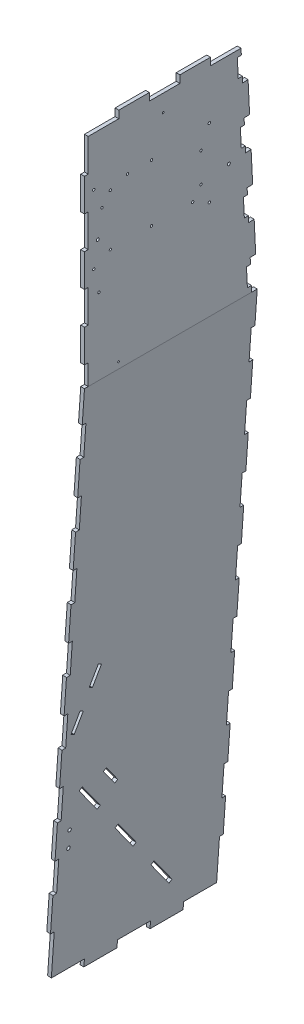
from build123d import *

# Parameters (mm, degrees)
BOSS_EXTRUDE1_DEPTH      = 469.9
SKETCH2_W                = 10.16
SKETCH2_H                = 83.651125112
SKETCH2_H_2              = 83.677721465
SKETCH2_H_3              = 83.704317819
SKETCH2_H_4              = 83.730914172
SKETCH2_H_5              = 83.757510526
SKETCH2_H_6              = 83.784106879
SKETCH2_H_7              = 83.810703233
SKETCH2_H_8              = 133.264269193
CUT_EXTRUDE1_DEPTH       = 10.16
SKETCH3_W                = 10.16
SKETCH3_H                = 55.879999965
SKETCH3_H_2              = 88.9
SKETCH3_H_3              = 109.22
CUT_EXTRUDE2_DEPTH       = 12.7
SKETCH4_W                = 83.144369377
SKETCH4_H                = 20.32
CUT_EXTRUDE3_DEPTH       = 12.7
SKETCH5_W                = 89.916
SKETCH5_H                = 20.32
CUT_EXTRUDE4_DEPTH       = 12.7
SKETCH13_R               = 3.175
CUT_EXTRUDE8_DEPTH       = 2128.667464702
SKETCH20_R               = 4.7625
CUT_EXTRUDE10_DEPTH      = 2107.728843747
SKETCH24_R               = 3.175
CUT_EXTRUDE12_DEPTH      = 12.7
CUT_EXTRUDE13_DEPTH      = 2128.667464702
CUT_EXTRUDE13_DEPTH_BACK = 2128.667464702
SKETCH30_R               = 4
CUT_EXTRUDE16_DEPTH      = 18
SKETCH31_R               = 2.38125
CUT_EXTRUDE17_DEPTH      = 20
CUT_EXTRUDE18_DEPTH      = 2128.667464702
CUT_EXTRUDE18_DEPTH_BACK = 2128.667464702


with BuildPart() as part:
    # Sketch1 → Boss-Extrude1 (new body)
    with BuildSketch(Plane.XY):
        Polygon((-215.881789204, 2052.32), (-215.881789204, 1463.040000035), (-316.088635901, 20.32), (-317.499999939, 0), (-307.333509538, 0), (-205.715298803, 1463.040000035), (-205.715298803, 2072.64), (-215.881789204, 2072.64), align=None)
    extrude(amount=-BOSS_EXTRUDE1_DEPTH)

    # Sketch2 → Cut-Extrude1 (cut)
    with BuildSketch(Plane(origin=(-315.975651309, 21.946686571, 0), x_dir=(0, 0, 1), z_dir=(-0.9975965627192115, 0.06928995634877068, 0))):
        with Locations((-464.82, 1313.852971026)):
            Rectangle(SKETCH2_W, SKETCH2_H)
        with Locations((-464.82, 1136.066269203)):
            Rectangle(SKETCH2_W, SKETCH2_H_2)
        with Locations((-464.82, 958.27956738)):
            Rectangle(SKETCH2_W, SKETCH2_H_3)
        with Locations((-464.82, 780.492865556)):
            Rectangle(SKETCH2_W, SKETCH2_H_4)
        with Locations((-464.82, 602.706163733)):
            Rectangle(SKETCH2_W, SKETCH2_H_5)
        with Locations((-464.82, 424.91946191)):
            Rectangle(SKETCH2_W, SKETCH2_H_6)
        with Locations((-464.82, 247.132760087)):
            Rectangle(SKETCH2_W, SKETCH2_H_7)
        with Locations((-464.82, 44.63257346)):
            Rectangle(SKETCH2_W, SKETCH2_H_8)
        with Locations((-5.08, 44.63257346)):
            Rectangle(SKETCH2_W, SKETCH2_H_8)
        with Locations((-5.08, 247.132760087)):
            Rectangle(SKETCH2_W, SKETCH2_H_7)
        with Locations((-5.08, 424.91946191)):
            Rectangle(SKETCH2_W, SKETCH2_H_6)
        with Locations((-5.08, 602.706163733)):
            Rectangle(SKETCH2_W, SKETCH2_H_5)
        with Locations((-5.08, 780.492865556)):
            Rectangle(SKETCH2_W, SKETCH2_H_4)
        with Locations((-5.08, 958.27956738)):
            Rectangle(SKETCH2_W, SKETCH2_H_3)
        with Locations((-5.08, 1136.066269203)):
            Rectangle(SKETCH2_W, SKETCH2_H_2)
        with Locations((-5.08, 1313.852971026)):
            Rectangle(SKETCH2_W, SKETCH2_H)
    extrude(amount=-CUT_EXTRUDE1_DEPTH, mode=Mode.SUBTRACT)

    # Sketch3 → Cut-Extrude2 (cut)
    with BuildSketch(Plane.ZY.offset(215.881789204)):
        with Locations((-5.08, 1490.980000018)):
            Rectangle(SKETCH3_W, SKETCH3_H)
        with Locations((-5.08, 1652.27)):
            Rectangle(SKETCH3_W, SKETCH3_H_2)
        Polygon((-469.9, 1463.040000035), (-454.881846886, 1463.040000035), (-450.77009056, 1546.590888577), (-465.751959388, 1547.328185272), (-461.603918775, 1631.616370509), (-446.622049947, 1630.879073814), (-442.474009335, 1715.167259052), (-457.455878163, 1715.904555746), (-453.307837551, 1800.192740983), (-438.325968723, 1799.455444289), (-434.17792811, 1883.743629526), (-449.159796939, 1884.48092622), (-445.011756326, 1968.769111457), (-430.029887498, 1968.031814763), (-424.881846886, 2072.64), (-469.9, 2072.64), align=None)
        with Locations((-5.08, 1830.07)):
            Rectangle(SKETCH3_W, SKETCH3_H_2)
        with Locations((-5.08, 2018.03)):
            Rectangle(SKETCH3_W, SKETCH3_H_3)
    extrude(amount=-CUT_EXTRUDE2_DEPTH, mode=Mode.SUBTRACT)

    # Sketch4 → Cut-Extrude3 (cut)
    with BuildSketch(Plane.ZY.offset(215.881789204)):
        with Locations((-384.309662198, 2062.48)):
            Rectangle(SKETCH4_W, SKETCH4_H)
        with Locations((-218.020923443, 2062.48)):
            Rectangle(SKETCH4_W, SKETCH4_H)
        with Locations((-51.732184688, 2062.48)):
            Rectangle(SKETCH4_W, SKETCH4_H)
    extrude(amount=-CUT_EXTRUDE3_DEPTH, mode=Mode.SUBTRACT)

    # Sketch5 → Cut-Extrude4 (cut)
    with BuildSketch(Plane(origin=(-315.975651309, 21.946686571, 0), x_dir=(0, 0, 1), z_dir=(-0.9975965627192115, 0.06928995634877068, 0))):
        with Locations((-414.782, -11.839561137)):
            Rectangle(SKETCH5_W, SKETCH5_H)
        with Locations((-234.95, -11.839561137)):
            Rectangle(SKETCH5_W, SKETCH5_H)
        with Locations((-55.118, -11.839561137)):
            Rectangle(SKETCH5_W, SKETCH5_H)
    extrude(amount=-CUT_EXTRUDE4_DEPTH, mode=Mode.SUBTRACT)

    # Sketch13 → Cut-Extrude8 (cut, through all)
    with BuildSketch(Plane.ZY.offset(215.881789204)):
        with Locations((-25.246459893, 1731.87)):
            Circle(SKETCH13_R)
        with Locations((-70.408959893, 1755.42)):
            Circle(SKETCH13_R)
        with Locations((-182.408959893, 1755.42)):
            Circle(SKETCH13_R)
        with Locations((-25.246459893, 1918.97)):
            Circle(SKETCH13_R)
        with Locations((-47.788959893, 1865.42)):
            Circle(SKETCH13_R)
        with Locations((-182.408959893, 1910.42)):
            Circle(SKETCH13_R)
        with Locations((-117.078959893, 1910.42)):
            Circle(SKETCH13_R)
        with Locations((-70.408959893, 1895.42)):
            Circle(SKETCH13_R)
        with Locations((-317.028959893, 1865.42)):
            Circle(SKETCH13_R)
        with Locations((-294.408959893, 1755.42)):
            Circle(SKETCH13_R)
        with Locations((-317.028959893, 1785.42)):
            Circle(SKETCH13_R)
        with Locations((-339.571459893, 1731.87)):
            Circle(SKETCH13_R)
        with Locations((-339.571459893, 1918.97)):
            Circle(SKETCH13_R)
    extrude(amount=-CUT_EXTRUDE8_DEPTH, mode=Mode.SUBTRACT)

    # Sketch20 → Cut-Extrude10 (cut, through all)
    with BuildSketch(Plane(origin=(-315.975651309, 21.946686571, 0), x_dir=(0, 0, 1), z_dir=(-0.9975965627192116, 0.06928995634876853, 0))):
        Polygon((-128.598334701, 451.361418049), (-162.492565561, 405.347250509), (-154.823537638, 399.698212032), (-120.929306778, 445.712379572), align=None)
        with Locations((-35.56, 347.287639338)):
            Circle(SKETCH20_R)
        with Locations((-35.56, 302.837639338)):
            Circle(SKETCH20_R)
    extrude(amount=-CUT_EXTRUDE10_DEPTH, mode=Mode.SUBTRACT)

    # Sketch24 → Cut-Extrude12 (cut)
    with BuildSketch(Plane.ZY.offset(215.881789204)):
        with Locations((-39.313746491, 1670.454214013)):
            Circle(SKETCH24_R)
    extrude(amount=-CUT_EXTRUDE12_DEPTH, mode=Mode.SUBTRACT)

    # Sketch26 → Cut-Extrude13 (cut, two sides: drawn at the far end of the back side and taken through both)
    with BuildSketch(Plane.ZY.offset(215.881789204).offset(-CUT_EXTRUDE13_DEPTH_BACK)):
        Polygon((-96.478494721, 741.073656933), (-74.89887104, 694.944067742), (-65.68812669, 699.232207156), (-87.26775037, 745.361796346), align=None)
        Polygon((-31.73962368, 602.684889361), (-22.52887933, 606.973028774), (-44.10850301, 653.102617965), (-53.31924736, 648.814478552), align=None)
        Polygon((-63.755697238, 458.569669358), (-117.688081031, 385.528057798), (-109.500847052, 379.511801077), (-55.568463259, 452.553412636), align=None)
        Polygon((-333.417616206, 93.36161156), (-325.230382227, 87.345354838), (-271.297998434, 160.386966398), (-279.485232413, 166.403223119), align=None)
        Polygon((-225.552848619, 239.444834679), (-217.372552167, 233.433675887), (-163.440168374, 306.475287447), (-171.620464825, 312.486446238), align=None)
    extrude(amount=CUT_EXTRUDE13_DEPTH + CUT_EXTRUDE13_DEPTH_BACK, mode=Mode.SUBTRACT)

    # Sketch30 → Cut-Extrude16 (cut)
    with BuildSketch(Plane(origin=(-205.715298803, 0, 0), x_dir=(0, 0, -1), z_dir=(1, 0, 0))):
        with Locations((36.16, 1796.1325)):
            Circle(SKETCH30_R)
        with Locations((392.66, 1796.1325)):
            Circle(SKETCH30_R)
    extrude(amount=-CUT_EXTRUDE16_DEPTH, mode=Mode.SUBTRACT)

    # Sketch31 → Cut-Extrude17 (cut)
    with BuildSketch(Plane(origin=(-205.715298803, 0, 0), x_dir=(0, 0, -1), z_dir=(1, 0, 0))):
        with Locations((92.678761166, 1480.158992518)):
            Circle(SKETCH31_R)
        with Locations((214.096092748, 2006.075234986)):
            Circle(SKETCH31_R)
    extrude(amount=-CUT_EXTRUDE17_DEPTH, mode=Mode.SUBTRACT)

    # Sketch32 → Cut-Extrude18 (cut, two sides: drawn at the far end of the back side and taken through both)
    with BuildSketch(Plane.ZY.offset(215.881789204).offset(-CUT_EXTRUDE18_DEPTH_BACK)):
        Polygon((-418.295558172, 1984.269759199), (-415.798580033, 2035.008354964), (-426.707378123, 2035.545205264), (-429.204356261, 1984.806609499), align=None)
        Polygon((-426.591639396, 1815.693388725), (-424.094661258, 1866.43198449), (-435.003459347, 1866.96883479), (-437.500437486, 1816.230239025), align=None)
        Polygon((-434.887720621, 1647.117018251), (-432.390742483, 1697.855614016), (-443.299540572, 1698.392464315), (-445.79651871, 1647.653868551), align=None)
        Polygon((-443.165659702, 1478.909296124), (-440.668681564, 1529.647891889), (-451.577479654, 1530.184742188), (-454.074457792, 1479.446146424), align=None)
    extrude(amount=CUT_EXTRUDE18_DEPTH + CUT_EXTRUDE18_DEPTH_BACK, mode=Mode.SUBTRACT)


solid = part.part
